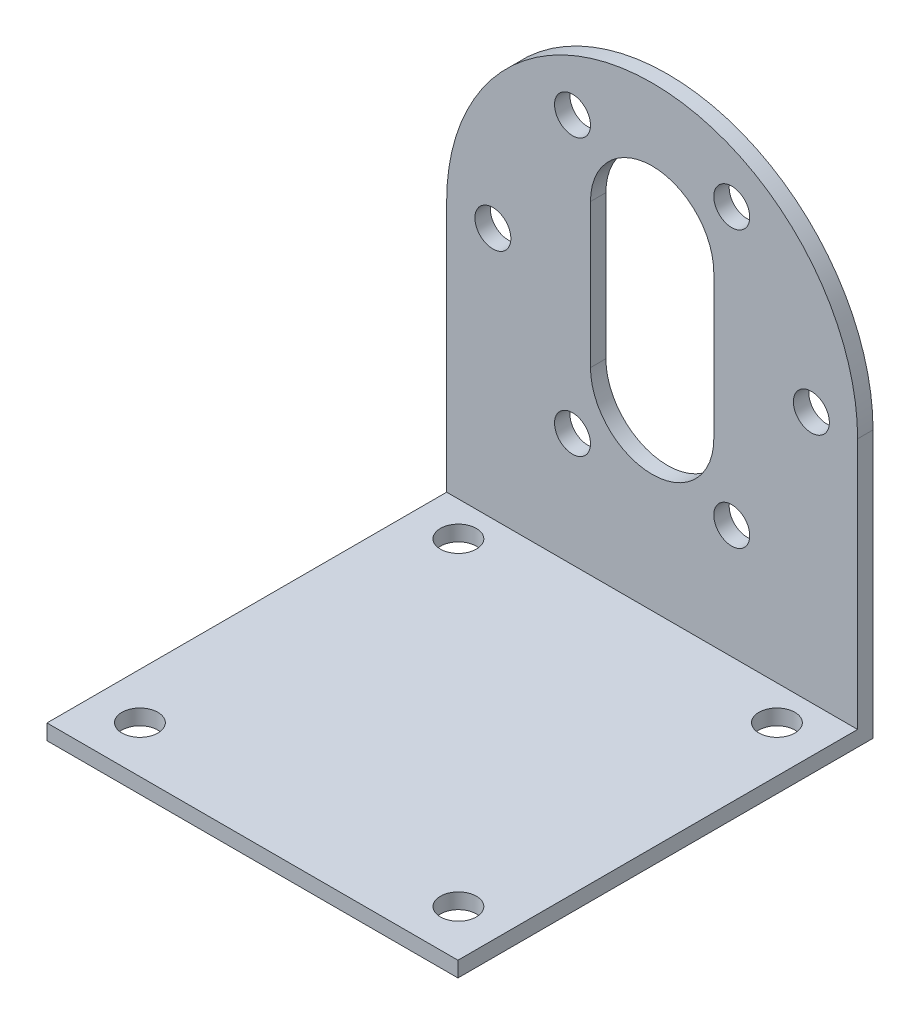
from build123d import *

# Parameters (mm, degrees)
SKETCH1_R           = 1.75
BOSS_EXTRUDE1_DEPTH = 1.5
SKETCH2_W           = 40
SKETCH2_H           = 40.4
SKETCH2_R           = 1.75
BOSS_EXTRUDE2_DEPTH = 1.5


with BuildPart() as part:
    # Sketch1 → Boss-Extrude1 (new body)
    # profile 1 of 2: a face of its own
    with BuildSketch(Plane.XY):
        with BuildLine():
            Line((0, 26), (0, 0))
            Line((0, 0), (40, 0))
            Line((40, 0), (40, 26))
            Line((40, 26), (37.25, 26))
            ThreePointArc((37.25, 26), (35.5, 24.25), (33.75, 26))
            Line((33.75, 26), (26, 26))
            Line((26, 26), (26, 19))
            ThreePointArc((26, 19), (20, 13), (14, 19))
            Line((14, 19), (14, 26))
            Line((14, 26), (6.25, 26))
            ThreePointArc((6.25, 26), (4.5, 24.25), (2.75, 26))
            Line((2.75, 26), (0, 26))
        make_face()
        with Locations((12.25, 12.576606241)):
            Circle(SKETCH1_R, mode=Mode.SUBTRACT)
        with Locations((27.75, 12.576606241)):
            Circle(SKETCH1_R, mode=Mode.SUBTRACT)
    # profile 2 of 2: a face of its own
    with BuildSketch(Plane.XY):
        with BuildLine():
            ThreePointArc((40, 26), (20, 46), (0, 26))
            Line((0, 26), (2.75, 26))
            ThreePointArc((2.75, 26), (4.5, 27.75), (6.25, 26))
            Line((6.25, 26), (14, 26))
            Line((14, 26), (14, 33))
            ThreePointArc((14, 33), (20, 39), (26, 33))
            Line((26, 33), (26, 26))
            Line((26, 26), (33.75, 26))
            ThreePointArc((33.75, 26), (35.5, 27.75), (37.25, 26))
            Line((37.25, 26), (40, 26))
        make_face()
        with Locations((12.25, 39.423393759)):
            Circle(SKETCH1_R, mode=Mode.SUBTRACT)
        with Locations((27.75, 39.423393759)):
            Circle(SKETCH1_R, mode=Mode.SUBTRACT)
    extrude(amount=BOSS_EXTRUDE1_DEPTH)

    # Sketch2 → Boss-Extrude2 (add)
    with BuildSketch(Plane.XZ):
        with Locations((20, 20.2)):
            Rectangle(SKETCH2_W, SKETCH2_H)
        with Locations(Location((4.5, 35.855, 0), (0, 0, 270))):
            Circle(SKETCH2_R, mode=Mode.SUBTRACT)
        with Locations(Location((35.5, 35.855, 0), (0, 0, 270))):
            Circle(SKETCH2_R, mode=Mode.SUBTRACT)
        with Locations(Location((35.5, 4.855, 0), (0, 0, 270))):
            Circle(SKETCH2_R, mode=Mode.SUBTRACT)
        with Locations(Location((4.5, 4.855, 0), (0, 0, 270))):
            Circle(SKETCH2_R, mode=Mode.SUBTRACT)
    extrude(amount=-BOSS_EXTRUDE2_DEPTH)


solid = part.part
